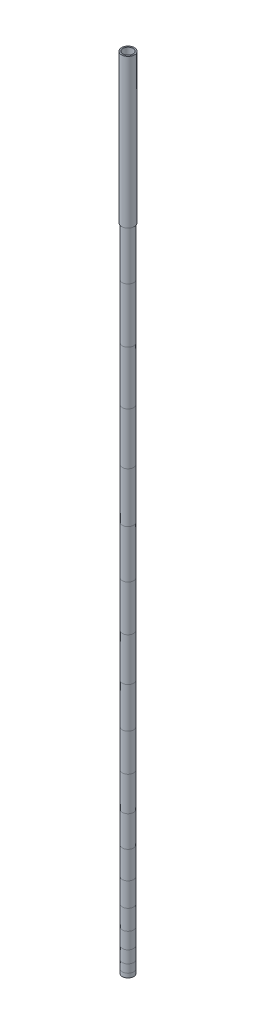
from build123d import *

# Parameters (mm, degrees)
SCHIZZO1_R                    = 8
SCHIZZO1_R_2                  = 7
ESTRUSIONE_ESTRUSIONE1_DEPTH  = 5.8
SCHIZZO3_R                    = 8
ESTRUSIONE_ESTRUSIONE2_DEPTH  = 11.4
SCHIZZO4_R                    = 8
ESTRUSIONE_ESTRUSIONE3_DEPTH  = 17.2
SCHIZZO5_R                    = 8
ESTRUSIONE_ESTRUSIONE4_DEPTH  = 22.7
SCHIZZO6_R                    = 8
ESTRUSIONE_ESTRUSIONE5_DEPTH  = 28.1
SCHIZZO7_R                    = 8
ESTRUSIONE_ESTRUSIONE6_DEPTH  = 33.5
SCHIZZO8_R                    = 8
ESTRUSIONE_ESTRUSIONE7_DEPTH  = 38.6
SCHIZZO9_R                    = 8
ESTRUSIONE_ESTRUSIONE8_DEPTH  = 43.5
SCHIZZO10_R                   = 8
ESTRUSIONE_ESTRUSIONE9_DEPTH  = 48.3
SCHIZZO11_R                   = 8
ESTRUSIONE_ESTRUSIONE10_DEPTH = 52.7
SCHIZZO12_R                   = 8
ESTRUSIONE_ESTRUSIONE11_DEPTH = 57
SCHIZZO13_R                   = 8
ESTRUSIONE_ESTRUSIONE12_DEPTH = 60.8
SCHIZZO14_R                   = 8
ESTRUSIONE_ESTRUSIONE13_DEPTH = 64.5
SCHIZZO15_R                   = 8
ESTRUSIONE_ESTRUSIONE14_DEPTH = 67.8
SCHIZZO16_R                   = 8
ESTRUSIONE_ESTRUSIONE15_DEPTH = 70.7
SCHIZZO17_R                   = 8
ESTRUSIONE_ESTRUSIONE16_DEPTH = 73.2
SCHIZZO18_R                   = 8
ESTRUSIONE_ESTRUSIONE17_DEPTH = 75.5
SCHIZZO19_R                   = 8
ESTRUSIONE_ESTRUSIONE18_DEPTH = 77.3
SCHIZZO20_R                   = 8
ESTRUSIONE_ESTRUSIONE19_DEPTH = 78.7
SCHIZZO21_R                   = 8
ESTRUSIONE_ESTRUSIONE20_DEPTH = 79.7
SCHIZZO22_R                   = 8
ESTRUSIONE_ESTRUSIONE21_DEPTH = 80.3
SCHIZZO23_R                   = 8
ESTRUSIONE_ESTRUSIONE22_DEPTH = 40.3
SCHIZZO24_R                   = 7
TAGLIO_ESTRUSIONE1_DEPTH      = 1128.656756287
SCHIZZO25_R                   = 9
SCHIZZO25_R_2                 = 8
ESTRUSIONE_ESTRUSIONE23_DEPTH = 210


with BuildPart() as part:
    # Schizzo1 → Estrusione-Estrusione1 (new body)
    with BuildSketch(Plane(origin=(0, 0, 0), x_dir=(1, 0, 0), z_dir=(0, 1, 0))):
        with Locations(Location((0, 0, 0), (0, 0, 270))):
            Circle(SCHIZZO1_R)
        with Locations(Location((0, 0, 0), (0, 0, 270))):
            Circle(SCHIZZO1_R_2, mode=Mode.SUBTRACT)
    extrude(amount=ESTRUSIONE_ESTRUSIONE1_DEPTH)


with BuildPart() as body_2:
    # Schizzo3 → Estrusione-Estrusione2 (new body)
    with BuildSketch(Plane(origin=(0, 5.8, 0), x_dir=(1, 0, 0), z_dir=(0, 1, 0))):
        with Locations(Location((0, 0, 0), (0, 0, 270))):
            Circle(SCHIZZO3_R)
    extrude(amount=ESTRUSIONE_ESTRUSIONE2_DEPTH)


with BuildPart() as body_3:
    # Schizzo4 → Estrusione-Estrusione3 (new body)
    with BuildSketch(Plane(origin=(0, 17.2, 0), x_dir=(1, 0, 0), z_dir=(0, 1, 0))):
        with Locations(Location((0, 0, 0), (0, 0, 270))):
            Circle(SCHIZZO4_R)
    extrude(amount=ESTRUSIONE_ESTRUSIONE3_DEPTH)


with BuildPart() as body_4:
    # Schizzo5 → Estrusione-Estrusione4 (new body)
    with BuildSketch(Plane(origin=(0, 34.4, 0), x_dir=(1, 0, 0), z_dir=(0, 1, 0))):
        with Locations(Location((0, 0, 0), (0, 0, 90))):
            Circle(SCHIZZO5_R)
    extrude(amount=ESTRUSIONE_ESTRUSIONE4_DEPTH)


with BuildPart() as body_5:
    # Schizzo6 → Estrusione-Estrusione5 (new body)
    with BuildSketch(Plane(origin=(0, 57.1, 0), x_dir=(1, 0, 0), z_dir=(0, 1, 0))):
        with Locations(Location((0, 0, 0), (0, 0, 270))):
            Circle(SCHIZZO6_R)
    extrude(amount=ESTRUSIONE_ESTRUSIONE5_DEPTH)


with BuildPart() as body_6:
    # Schizzo7 → Estrusione-Estrusione6 (new body)
    with BuildSketch(Plane(origin=(0, 85.2, 0), x_dir=(1, 0, 0), z_dir=(0, 1, 0))):
        with Locations(Location((0, 0, 0), (0, 0, 270))):
            Circle(SCHIZZO7_R)
    extrude(amount=ESTRUSIONE_ESTRUSIONE6_DEPTH)


with BuildPart() as body_7:
    # Schizzo8 → Estrusione-Estrusione7 (new body)
    with BuildSketch(Plane(origin=(0, 118.7, 0), x_dir=(1, 0, 0), z_dir=(0, 1, 0))):
        with Locations(Location((0, 0, 0), (0, 0, 270))):
            Circle(SCHIZZO8_R)
    extrude(amount=ESTRUSIONE_ESTRUSIONE7_DEPTH)


with BuildPart() as body_8:
    # Schizzo9 → Estrusione-Estrusione8 (new body)
    with BuildSketch(Plane(origin=(0, 157.3, 0), x_dir=(1, 0, 0), z_dir=(0, 1, 0))):
        with Locations(Location((0, 0, 0), (0, 0, 270))):
            Circle(SCHIZZO9_R)
    extrude(amount=ESTRUSIONE_ESTRUSIONE8_DEPTH)


with BuildPart() as body_9:
    # Schizzo10 → Estrusione-Estrusione9 (new body)
    with BuildSketch(Plane(origin=(0, 200.8, 0), x_dir=(1, 0, 0), z_dir=(0, 1, 0))):
        with Locations(Location((0, 0, 0), (0, 0, 270))):
            Circle(SCHIZZO10_R)
    extrude(amount=ESTRUSIONE_ESTRUSIONE9_DEPTH)


with BuildPart() as body_10:
    # Schizzo11 → Estrusione-Estrusione10 (new body)
    with BuildSketch(Plane(origin=(0, 249.1, 0), x_dir=(1, 0, 0), z_dir=(0, 1, 0))):
        with Locations(Location((0, 0, 0), (0, 0, 270))):
            Circle(SCHIZZO11_R)
    extrude(amount=ESTRUSIONE_ESTRUSIONE10_DEPTH)


with BuildPart() as body_11:
    # Schizzo12 → Estrusione-Estrusione11 (new body)
    with BuildSketch(Plane(origin=(0, 301.8, 0), x_dir=(1, 0, 0), z_dir=(0, 1, 0))):
        with Locations(Location((0, 0, 0), (0, 0, 270))):
            Circle(SCHIZZO12_R)
    extrude(amount=ESTRUSIONE_ESTRUSIONE11_DEPTH)


with BuildPart() as body_12:
    # Schizzo13 → Estrusione-Estrusione12 (new body)
    with BuildSketch(Plane(origin=(0, 358.8, 0), x_dir=(1, 0, 0), z_dir=(0, 1, 0))):
        with Locations(Location((0, 0, 0), (0, 0, 270))):
            Circle(SCHIZZO13_R)
    extrude(amount=ESTRUSIONE_ESTRUSIONE12_DEPTH)


with BuildPart() as body_13:
    # Schizzo14 → Estrusione-Estrusione13 (new body)
    with BuildSketch(Plane(origin=(0, 419.6, 0), x_dir=(1, 0, 0), z_dir=(0, 1, 0))):
        with Locations(Location((0, 0, 0), (0, 0, 270))):
            Circle(SCHIZZO14_R)
    extrude(amount=ESTRUSIONE_ESTRUSIONE13_DEPTH)


with BuildPart() as body_14:
    # Schizzo15 → Estrusione-Estrusione14 (new body)
    with BuildSketch(Plane(origin=(0, 484.1, 0), x_dir=(1, 0, 0), z_dir=(0, 1, 0))):
        with Locations(Location((0, 0, 0), (0, 0, 270))):
            Circle(SCHIZZO15_R)
    extrude(amount=ESTRUSIONE_ESTRUSIONE14_DEPTH)


with BuildPart() as body_15:
    # Schizzo16 → Estrusione-Estrusione15 (new body)
    with BuildSketch(Plane(origin=(0, 551.9, 0), x_dir=(1, 0, 0), z_dir=(0, 1, 0))):
        with Locations(Location((0, 0, 0), (0, 0, 270))):
            Circle(SCHIZZO16_R)
    extrude(amount=ESTRUSIONE_ESTRUSIONE15_DEPTH)


with BuildPart() as body_16:
    # Schizzo17 → Estrusione-Estrusione16 (new body)
    with BuildSketch(Plane(origin=(0, 622.6, 0), x_dir=(1, 0, 0), z_dir=(0, 1, 0))):
        with Locations(Location((0, 0, 0), (0, 0, 270))):
            Circle(SCHIZZO17_R)
    extrude(amount=ESTRUSIONE_ESTRUSIONE16_DEPTH)


with BuildPart() as body_17:
    # Schizzo18 → Estrusione-Estrusione17 (new body)
    with BuildSketch(Plane(origin=(0, 695.8, 0), x_dir=(1, 0, 0), z_dir=(0, 1, 0))):
        with Locations(Location((0, 0, 0), (0, 0, 270))):
            Circle(SCHIZZO18_R)
    extrude(amount=ESTRUSIONE_ESTRUSIONE17_DEPTH)


with BuildPart() as body_18:
    # Schizzo19 → Estrusione-Estrusione18 (new body)
    with BuildSketch(Plane(origin=(0, 771.3, 0), x_dir=(1, 0, 0), z_dir=(0, 1, 0))):
        with Locations(Location((0, 0, 0), (0, 0, 270))):
            Circle(SCHIZZO19_R)
    extrude(amount=ESTRUSIONE_ESTRUSIONE18_DEPTH)


with BuildPart() as body_19:
    # Schizzo20 → Estrusione-Estrusione19 (new body)
    with BuildSketch(Plane(origin=(0, 848.6, 0), x_dir=(1, 0, 0), z_dir=(0, 1, 0))):
        with Locations(Location((0, 0, 0), (0, 0, 90))):
            Circle(SCHIZZO20_R)
    extrude(amount=ESTRUSIONE_ESTRUSIONE19_DEPTH)


with BuildPart() as body_20:
    # Schizzo21 → Estrusione-Estrusione20 (new body)
    with BuildSketch(Plane(origin=(0, 927.3, 0), x_dir=(1, 0, 0), z_dir=(0, 1, 0))):
        with Locations(Location((0, 0, 0), (0, 0, 90))):
            Circle(SCHIZZO21_R)
    extrude(amount=ESTRUSIONE_ESTRUSIONE20_DEPTH)


with BuildPart() as body_21:
    # Schizzo22 → Estrusione-Estrusione21 (new body)
    with BuildSketch(Plane(origin=(0, 1007, 0), x_dir=(1, 0, 0), z_dir=(0, 1, 0))):
        with Locations(Location((0, 0, 0), (0, 0, 90))):
            Circle(SCHIZZO22_R)
    extrude(amount=ESTRUSIONE_ESTRUSIONE21_DEPTH)


with BuildPart() as body_22:
    # Schizzo23 → Estrusione-Estrusione22 (new body)
    with BuildSketch(Plane(origin=(0, 1087.3, 0), x_dir=(1, 0, 0), z_dir=(0, 1, 0))):
        with Locations(Location((0, 0, 0), (0, 0, 270))):
            Circle(SCHIZZO23_R)
    extrude(amount=ESTRUSIONE_ESTRUSIONE22_DEPTH)


with BuildPart() as taglio_estrusione1_tool:
    # Schizzo24 → Taglio-Estrusione1 (new, through all)
    with BuildSketch(Plane(origin=(0, 1127.6, 0), x_dir=(1, 0, 0), z_dir=(0, 1, 0))):
        with Locations(Location((0, 0, 0), (0, 0, 270))):
            Circle(SCHIZZO24_R)
    extrude(amount=-TAGLIO_ESTRUSIONE1_DEPTH)


with BuildPart() as body_2_1:
    add(body_2.part)

    # Taglio-Estrusione1: cut by taglio_estrusione1_tool
    add(taglio_estrusione1_tool.part, mode=Mode.SUBTRACT)


with BuildPart() as body_3_1:
    add(body_3.part)

    # Taglio-Estrusione1: cut by taglio_estrusione1_tool
    add(taglio_estrusione1_tool.part, mode=Mode.SUBTRACT)


with BuildPart() as body_4_1:
    add(body_4.part)

    # Taglio-Estrusione1: cut by taglio_estrusione1_tool
    add(taglio_estrusione1_tool.part, mode=Mode.SUBTRACT)


with BuildPart() as body_5_1:
    add(body_5.part)

    # Taglio-Estrusione1: cut by taglio_estrusione1_tool
    add(taglio_estrusione1_tool.part, mode=Mode.SUBTRACT)


with BuildPart() as body_6_1:
    add(body_6.part)

    # Taglio-Estrusione1: cut by taglio_estrusione1_tool
    add(taglio_estrusione1_tool.part, mode=Mode.SUBTRACT)


with BuildPart() as body_7_1:
    add(body_7.part)

    # Taglio-Estrusione1: cut by taglio_estrusione1_tool
    add(taglio_estrusione1_tool.part, mode=Mode.SUBTRACT)


with BuildPart() as body_8_1:
    add(body_8.part)

    # Taglio-Estrusione1: cut by taglio_estrusione1_tool
    add(taglio_estrusione1_tool.part, mode=Mode.SUBTRACT)


with BuildPart() as body_9_1:
    add(body_9.part)

    # Taglio-Estrusione1: cut by taglio_estrusione1_tool
    add(taglio_estrusione1_tool.part, mode=Mode.SUBTRACT)


with BuildPart() as body_10_1:
    add(body_10.part)

    # Taglio-Estrusione1: cut by taglio_estrusione1_tool
    add(taglio_estrusione1_tool.part, mode=Mode.SUBTRACT)


with BuildPart() as body_11_1:
    add(body_11.part)

    # Taglio-Estrusione1: cut by taglio_estrusione1_tool
    add(taglio_estrusione1_tool.part, mode=Mode.SUBTRACT)


with BuildPart() as body_12_1:
    add(body_12.part)

    # Taglio-Estrusione1: cut by taglio_estrusione1_tool
    add(taglio_estrusione1_tool.part, mode=Mode.SUBTRACT)


with BuildPart() as body_13_1:
    add(body_13.part)

    # Taglio-Estrusione1: cut by taglio_estrusione1_tool
    add(taglio_estrusione1_tool.part, mode=Mode.SUBTRACT)


with BuildPart() as body_14_1:
    add(body_14.part)

    # Taglio-Estrusione1: cut by taglio_estrusione1_tool
    add(taglio_estrusione1_tool.part, mode=Mode.SUBTRACT)


with BuildPart() as body_15_1:
    add(body_15.part)

    # Taglio-Estrusione1: cut by taglio_estrusione1_tool
    add(taglio_estrusione1_tool.part, mode=Mode.SUBTRACT)


with BuildPart() as body_16_1:
    add(body_16.part)

    # Taglio-Estrusione1: cut by taglio_estrusione1_tool
    add(taglio_estrusione1_tool.part, mode=Mode.SUBTRACT)


with BuildPart() as body_17_1:
    add(body_17.part)

    # Taglio-Estrusione1: cut by taglio_estrusione1_tool
    add(taglio_estrusione1_tool.part, mode=Mode.SUBTRACT)


with BuildPart() as body_18_1:
    add(body_18.part)

    # Taglio-Estrusione1: cut by taglio_estrusione1_tool
    add(taglio_estrusione1_tool.part, mode=Mode.SUBTRACT)


with BuildPart() as body_19_1:
    add(body_19.part)

    # Taglio-Estrusione1: cut by taglio_estrusione1_tool
    add(taglio_estrusione1_tool.part, mode=Mode.SUBTRACT)


with BuildPart() as body_20_1:
    add(body_20.part)

    # Taglio-Estrusione1: cut by taglio_estrusione1_tool
    add(taglio_estrusione1_tool.part, mode=Mode.SUBTRACT)


with BuildPart() as body_21_1:
    add(body_21.part)

    # Taglio-Estrusione1: cut by taglio_estrusione1_tool
    add(taglio_estrusione1_tool.part, mode=Mode.SUBTRACT)


with BuildPart() as body_22_1:
    add(body_22.part)

    # Taglio-Estrusione1: cut by taglio_estrusione1_tool
    add(taglio_estrusione1_tool.part, mode=Mode.SUBTRACT)


with BuildPart() as body_23:
    # Schizzo25 → Estrusione-Estrusione23 (new body)
    with BuildSketch(Plane(origin=(0, 1127.6, 0), x_dir=(1, 0, 0), z_dir=(0, 1, 0))):
        with Locations(Location((0, 0, 0), (0, 0, 270))):
            Circle(SCHIZZO25_R)
        with Locations(Location((0, 0, 0), (0, 0, 270))):
            Circle(SCHIZZO25_R_2, mode=Mode.SUBTRACT)
    extrude(amount=-ESTRUSIONE_ESTRUSIONE23_DEPTH)


solid = Compound([part.part, body_2_1.part, body_3_1.part, body_4_1.part, body_5_1.part, body_6_1.part, body_7_1.part, body_8_1.part, body_9_1.part, body_10_1.part, body_11_1.part, body_12_1.part, body_13_1.part, body_14_1.part, body_15_1.part, body_16_1.part, body_17_1.part, body_18_1.part, body_19_1.part, body_20_1.part, body_21_1.part, body_22_1.part, body_23.part])
